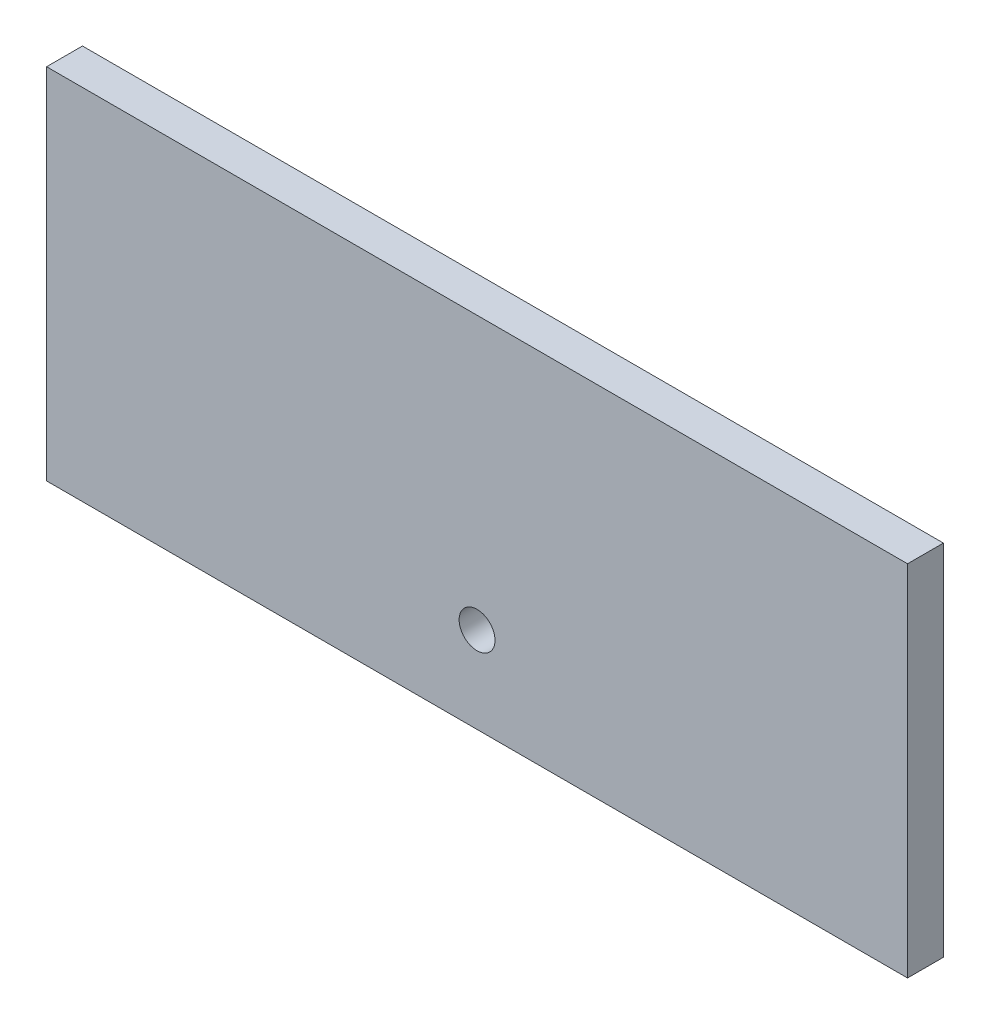
from build123d import *

# Parameters (mm, degrees)
SKETCH1_W           = 152.4
SKETCH1_H           = 63.5
SKETCH1_R           = 3.175
BOSS_EXTRUDE1_DEPTH = 6.35


with BuildPart() as part:
    # Sketch1 → Boss-Extrude1 (new body)
    with BuildSketch(Plane.XY):
        with Locations((76.2, 31.75)):
            Rectangle(SKETCH1_W, SKETCH1_H)
        with Locations((76.2, 15.24)):
            Circle(SKETCH1_R, mode=Mode.SUBTRACT)
    extrude(amount=BOSS_EXTRUDE1_DEPTH)


solid = part.part
